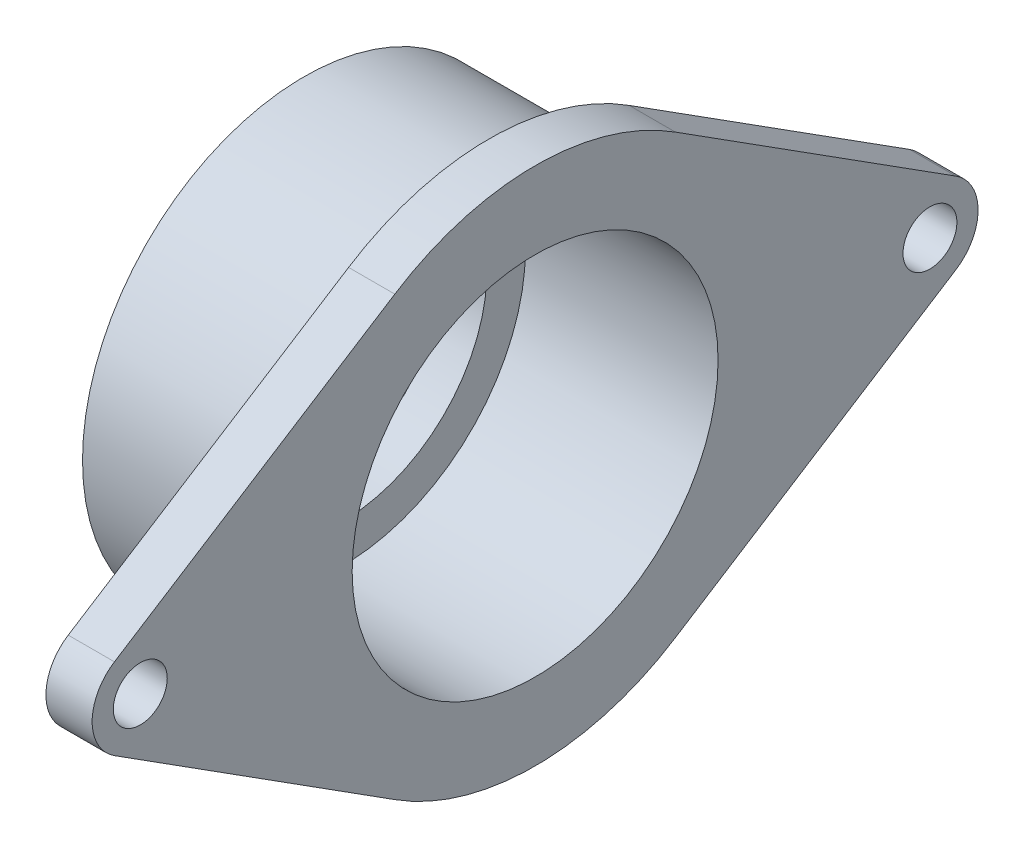
from build123d import *

# Parameters (mm, degrees)
BOSS_EXTRUDE1_START = -12
SKETCH2_R           = 57.5
BOSS_EXTRUDE1_DEPTH = 12
SKETCH3_R           = 7
CUT_EXTRUDE1_DEPTH  = 12


with BuildPart() as part:
    # Sketch1 → Revolve1 (revolve)
    with BuildSketch(Plane.XY, mode=Mode.PRIVATE) as revolve1_sk:
        Polygon((-75.893975687, 34.641714336), (-25.893975687, 34.641714336), (-25.893975687, 44.641714336), (-85.893975687, 44.641714336), (-85.893975687, 24.641714336), (-75.893975687, 24.641714336), align=None)
    revolve(revolve1_sk.sketch.rotate(Axis((-85.893975687, -12.858285664, 0), (1, 0, 0)), 90), axis=Axis((-85.893975687, -12.858285664, 0), (1, 0, 0)))

    # Sketch2 → Boss-Extrude1 (add)
    with BuildSketch(Plane(origin=(-25.893975687, 0, 0), x_dir=(0, 0, -1), z_dir=(1, 0, 0)).offset(BOSS_EXTRUDE1_START)):
        with BuildLine():
            Line((36.425087952, -69.686649776), (109.207263185, -23.406395474))
            ThreePointArc((109.207263185, -23.406395474), (115, -12.858285664), (109.207263185, -2.310175853))
            Line((109.207263185, -2.310175853), (36.425087952, 43.970078449))
            ThreePointArc((36.425087952, 43.970078449), (0, 54.641714336), (-36.425087952, 43.970078449))
            Line((-36.425087952, 43.970078449), (-109.207263185, -2.310175853))
            ThreePointArc((-109.207263185, -2.310175853), (-115, -12.858285664), (-109.207263185, -23.406395474))
            Line((-109.207263185, -23.406395474), (-36.425087952, -69.686649776))
            ThreePointArc((-36.425087952, -69.686649776), (0, -80.358285664), (36.425087952, -69.686649776))
        make_face()
        with Locations(Location((0, -12.858285664, 0), (0, 0, 180))):
            Circle(SKETCH2_R, mode=Mode.SUBTRACT)
    extrude(amount=BOSS_EXTRUDE1_DEPTH)

    # Sketch3 → Cut-Extrude1 (cut)
    with BuildSketch(Plane(origin=(-25.893975687, 0, 0), x_dir=(0, 0, -1), z_dir=(1, 0, 0))):
        with Locations((-102.5, -12.858285664)):
            Circle(SKETCH3_R)
        with Locations((102.5, -12.858285664)):
            Circle(SKETCH3_R)
    extrude(amount=-CUT_EXTRUDE1_DEPTH, mode=Mode.SUBTRACT)


solid = part.part
